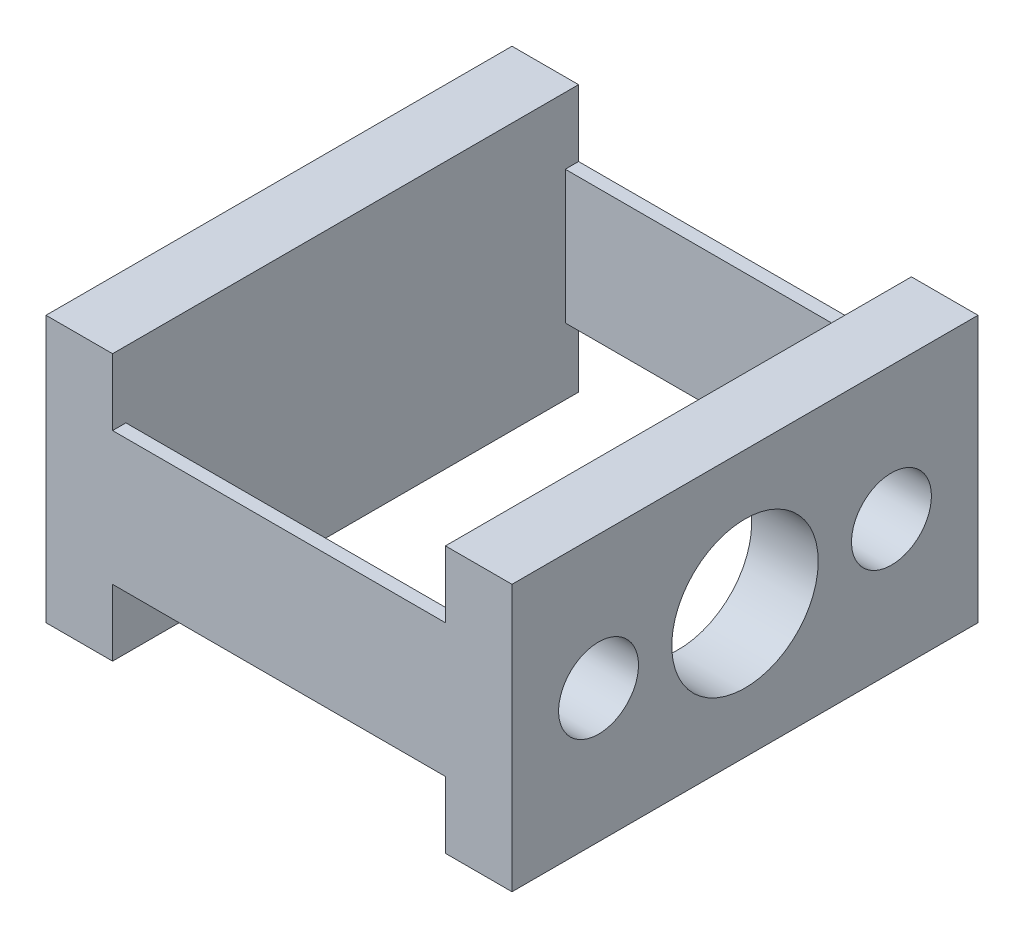
from build123d import *

# Parameters (mm, degrees)
BOSS_EXTRUDE1_DEPTH = 70
SKETCH3_W           = 50
SKETCH3_H           = 66
CUT_EXTRUDE1_DEPTH  = 88.388879183
SKETCH4_R           = 11
CUT_EXTRUDE2_DEPTH  = 10
SKETCH5_R           = 6
CUT_EXTRUDE3_DEPTH  = 10


with BuildPart() as part:
    # Sketch1 → Boss-Extrude1 (new body)
    with BuildSketch(Plane.XY):
        Polygon((-17.141906192, 0), (32.858093808, 0), (32.858093808, 10), (42.858093808, 10), (42.858093808, -30), (32.858093808, -30), (32.858093808, -20), (-17.141906192, -20), (-17.141906192, -30), (-27.141906192, -30), (-27.141906192, 10), (-17.141906192, 10), align=None)
    extrude(amount=BOSS_EXTRUDE1_DEPTH)

    # Sketch3 → Cut-Extrude1 (cut, through all)
    with BuildSketch(Plane(origin=(0, 0, 0), x_dir=(1, 0, 0), z_dir=(0, 1, 0))):
        with Locations((7.858093808, -35)):
            Rectangle(SKETCH3_W, SKETCH3_H)
    extrude(amount=-CUT_EXTRUDE1_DEPTH, mode=Mode.SUBTRACT)

    # Sketch4 → Cut-Extrude2 (cut)
    with BuildSketch(Plane(origin=(42.858093808, 0, 0), x_dir=(0, 0, -1), z_dir=(1, 0, 0))):
        with Locations((-35, -10)):
            Circle(SKETCH4_R)
    extrude(amount=-CUT_EXTRUDE2_DEPTH, mode=Mode.SUBTRACT)

    # Sketch5 → Cut-Extrude3 (cut)
    with BuildSketch(Plane(origin=(42.858093808, 0, 0), x_dir=(0, 0, -1), z_dir=(1, 0, 0))):
        with Locations((-13, -10)):
            Circle(SKETCH5_R)
        with Locations((-57, -10)):
            Circle(SKETCH5_R)
    extrude(amount=-CUT_EXTRUDE3_DEPTH, mode=Mode.SUBTRACT)


solid = part.part
